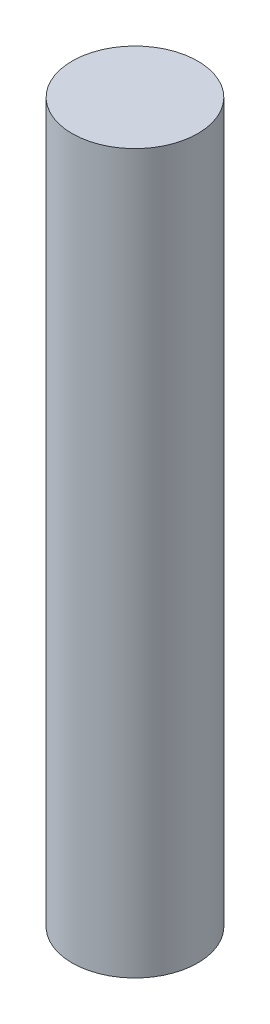
from build123d import *

# Parameters (mm, degrees)
SKETCH1_R           = 1.75
BOSS_EXTRUDE1_DEPTH = 20


with BuildPart() as part:
    # Sketch1 → Boss-Extrude1 (new body)
    with BuildSketch(Plane(origin=(0, 0, 0), x_dir=(1, 0, 0), z_dir=(0, 1, 0))):
        with Locations(Location((0, 0, 0), (0, 0, 270))):
            Circle(SKETCH1_R)
    extrude(amount=BOSS_EXTRUDE1_DEPTH)


solid = part.part
